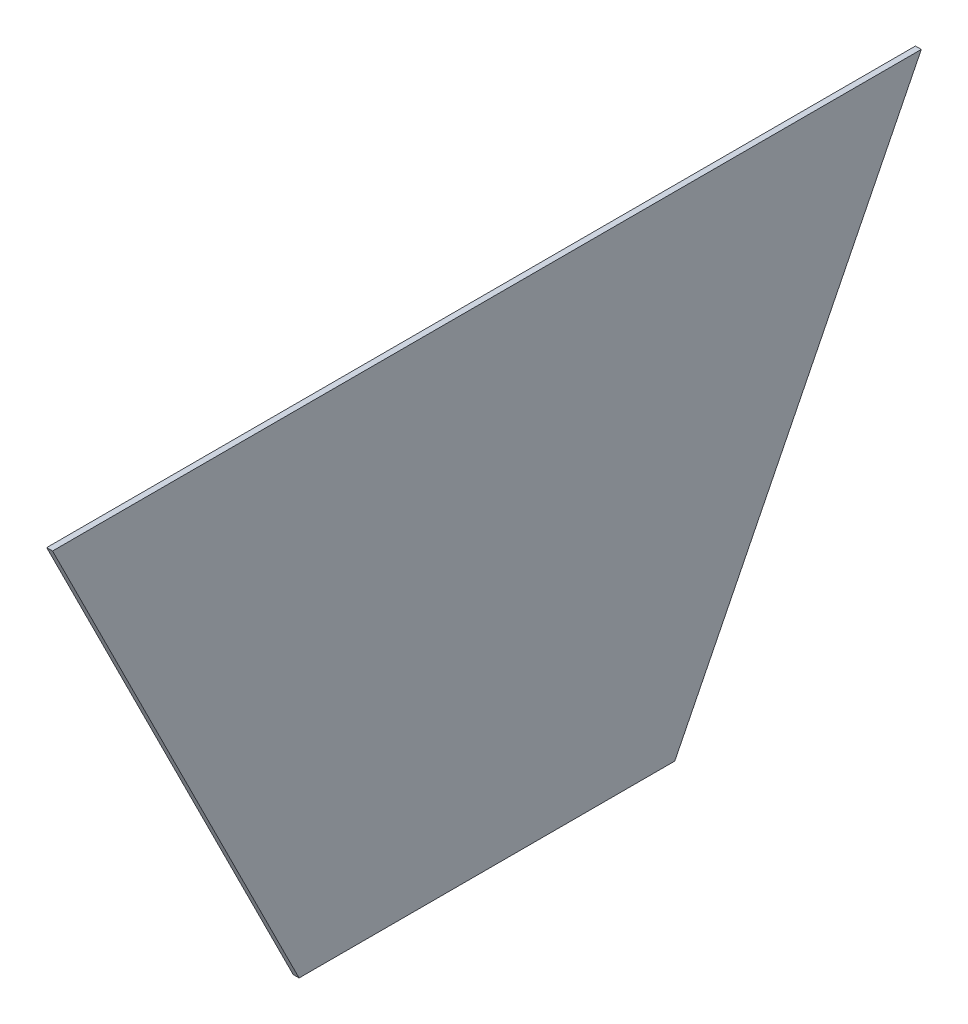
from build123d import *

# Parameters (mm, degrees)
BOSS_EXTRUDE1_DEPTH = 3.175


with BuildPart() as part:
    # Sketch1 → Boss-Extrude1 (new body)
    with BuildSketch(Plane(origin=(0, 0, 0), x_dir=(0, 0, -1), z_dir=(1, 0, 0))):
        Polygon((0, 0), (101.6, 0), (234.95, 266.7), (-234.95, 266.7), (-101.6, 0), align=None)
    extrude(amount=BOSS_EXTRUDE1_DEPTH)


solid = part.part
